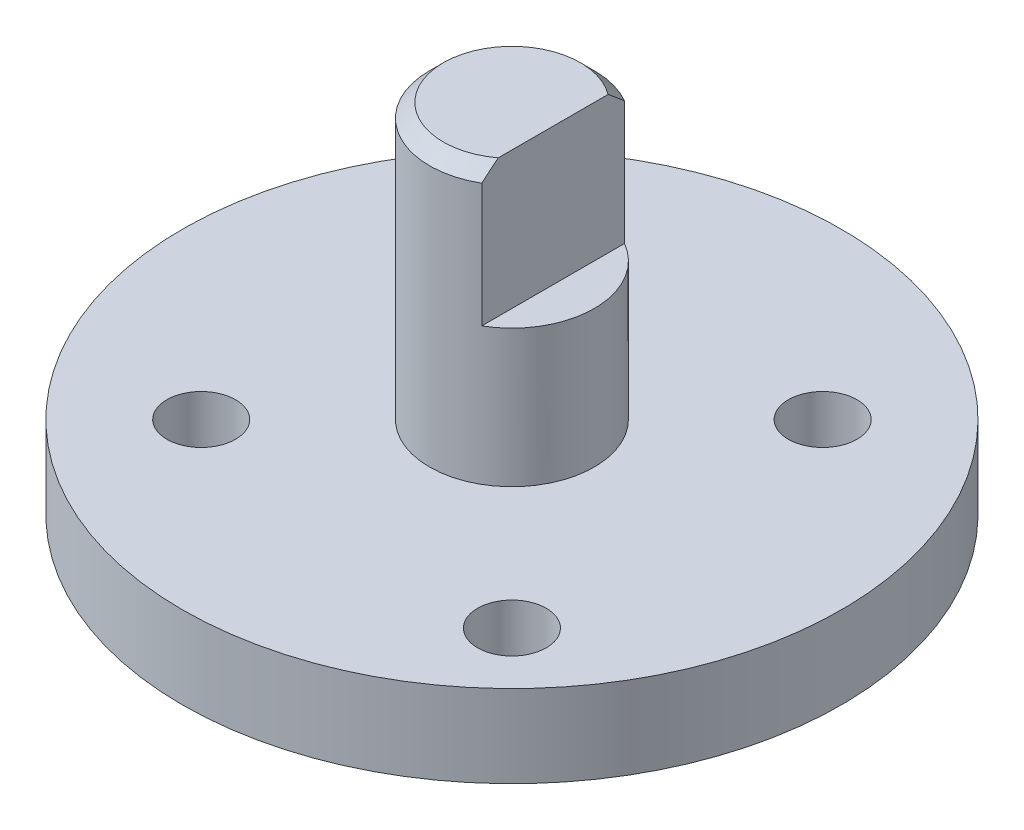
from build123d import *

# Parameters (mm, degrees)
CROQUIS1_R              = 12
CROQUIS1_R_2            = 1.25
SALIENTE_EXTRUIR1_DEPTH = 3
SALIENTE_EXTRUIR2_START = 3
CROQUIS1_3_R            = 3
SALIENTE_EXTRUIR2_DEPTH = 10
CORTAR_EXTRUIR1_START   = -5
CORTAR_EXTRUIR1_DEPTH   = 5
CHAFL_N1_SIZE           = 0.5


with BuildPart() as part:
    # Croquis1 → Saliente-Extruir1 (new body)
    with BuildSketch(Plane(origin=(0, 0, 0), x_dir=(1, 0, 0), z_dir=(0, 1, 0))):
        with Locations(Location((0, 0, 0), (0, 0, 270))):
            Circle(CROQUIS1_R)
        with Locations(Location((-6.576093065, 6.576093065, 0), (0, 0, 270))):
            Circle(CROQUIS1_R_2, mode=Mode.SUBTRACT)
        with Locations(Location((5.656854249, 5.656854249, 0), (0, 0, 270))):
            Circle(CROQUIS1_R_2, mode=Mode.SUBTRACT)
        with Locations(Location((6.576093065, -6.576093065, 0), (0, 0, 270))):
            Circle(CROQUIS1_R_2, mode=Mode.SUBTRACT)
        with Locations(Location((-5.656854249, -5.656854249, 0), (0, 0, 270))):
            Circle(CROQUIS1_R_2, mode=Mode.SUBTRACT)
    extrude(amount=SALIENTE_EXTRUIR1_DEPTH)

    # Croquis1<3> → Saliente-Extruir2 (add)
    with BuildSketch(Plane(origin=(0, 0, 0), x_dir=(1, 0, 0), z_dir=(0, 1, 0)).offset(SALIENTE_EXTRUIR2_START)):
        with Locations(Location((0, 0, 0), (0, 0, 270))):
            Circle(CROQUIS1_3_R)
    extrude(amount=SALIENTE_EXTRUIR2_DEPTH)

    # Croquis2 → Cortar-Extruir1 (cut)
    with BuildSketch(Plane(origin=(0, 13, 0), x_dir=(1, 0, 0), z_dir=(0, 1, 0)).offset(CORTAR_EXTRUIR1_START)):
        with BuildLine():
            Line((1.5, 2.598076211), (1.5, -2.598076211))
            ThreePointArc((1.5, -2.598076211), (3, 0), (1.5, 2.598076211))
        make_face()
    extrude(amount=CORTAR_EXTRUIR1_DEPTH, mode=Mode.SUBTRACT)

    # Chaflán1
    chafl_n1_edges = [part.edges().sort_by_distance(p)[0] for p in [
        (-2.897777479, 13, -0.776457135),
    ]]
    chamfer(chafl_n1_edges, length=CHAFL_N1_SIZE)


solid = part.part
